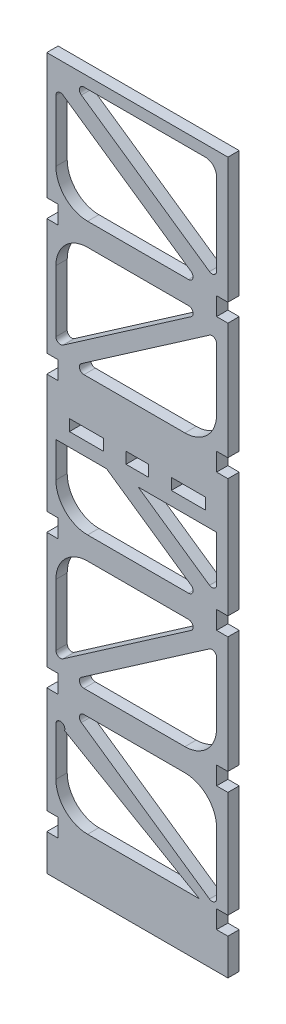
from build123d import *

# Parameters (mm, degrees)
MODEL_W             = 101.6
MODEL_H             = 398.78
BOSS_EXTRUDE1_DEPTH = 6.35
SKETCH1_W           = 6.35
SKETCH1_H           = 10.16
CUT_EXTRUDE1_DEPTH  = 6.35
SKETCH2_W           = 95.776452478
SKETCH2_H           = 26.67
BOSS_EXTRUDE2_DEPTH = 6.35
SKETCH3_W           = 19.05
SKETCH3_H           = 6.35
SKETCH3_W_2         = 12.7
CUT_EXTRUDE2_DEPTH  = 6.35


with BuildPart() as part:
    # Model → Boss-Extrude1 (new body)
    with BuildSketch(Plane.XY):
        with Locations((50.8, 199.39)):
            Rectangle(MODEL_W, MODEL_H)
        with BuildLine():
            Line((77.47, 87.63), (20.83121403, 87.63))
            ThreePointArc((20.83121403, 87.63), (18.406749642, 85.847345646), (19.385420684, 83.001631833))
            Line((19.385420684, 83.001631833), (91.264206654, 33.239395393))
            ThreePointArc((91.264206654, 33.239395393), (93.888830968, 33.077884107), (95.25, 35.32776356))
            Line((95.25, 35.32776356), (95.25, 69.85))
            ThreePointArc((95.25, 69.85), (90.042358569, 82.422358569), (77.47, 87.63))
        make_face(mode=Mode.SUBTRACT)
        with BuildLine():
            Line((5.110654516, 145.400145775), (5.110654516, 110.877909335))
            ThreePointArc((5.110654516, 110.877909335), (6.471823548, 108.628029883), (9.096447862, 108.789541168))
            Line((9.096447862, 108.789541168), (80.975233831, 158.551777608))
            ThreePointArc((80.975233831, 158.551777608), (81.953904874, 161.397491422), (79.529440485, 163.180145775))
            Line((79.529440485, 163.180145775), (22.890654516, 163.180145775))
            ThreePointArc((22.890654516, 163.180145775), (10.318295946, 157.972504345), (5.110654516, 145.400145775))
        make_face(mode=Mode.SUBTRACT)
        with BuildLine():
            Line((77.47, 240.03), (20.83121403, 240.03))
            ThreePointArc((20.83121403, 240.03), (18.406749642, 238.247345646), (19.385420684, 235.401631833))
            Line((19.385420684, 235.401631833), (91.264206654, 185.639395393))
            ThreePointArc((91.264206654, 185.639395393), (93.888830968, 185.477884107), (95.25, 187.72776356))
            Line((95.25, 187.72776356), (95.25, 222.25))
            ThreePointArc((95.25, 222.25), (90.042358569, 234.822358569), (77.47, 240.03))
        make_face(mode=Mode.SUBTRACT)
        with BuildLine():
            Line((22.890654516, 175.880145775), (79.529440485, 175.880145775))
            ThreePointArc((79.529440485, 175.880145775), (81.953904874, 177.662800129), (80.975233831, 180.508513942))
            Line((80.975233831, 180.508513942), (9.096447862, 230.270750382))
            ThreePointArc((9.096447862, 230.270750382), (6.471823548, 230.432261668), (5.110654516, 228.182382216))
            Line((5.110654516, 228.182382216), (5.110654516, 193.660145775))
            ThreePointArc((5.110654516, 193.660145775), (10.318295946, 181.087787206), (22.890654516, 175.880145775))
        make_face(mode=Mode.SUBTRACT)
        with BuildLine():
            Line((91.264206654, 154.720604607), (19.385420684, 104.958368167))
            ThreePointArc((19.385420684, 104.958368167), (18.406749642, 102.112654354), (20.83121403, 100.33))
            Line((20.83121403, 100.33), (77.47, 100.33))
            ThreePointArc((77.47, 100.33), (90.042358569, 105.537641431), (95.25, 118.11))
            Line((95.25, 118.11), (95.25, 152.63223644))
            ThreePointArc((95.25, 152.63223644), (93.888830968, 154.882115893), (91.264206654, 154.720604607))
        make_face(mode=Mode.SUBTRACT)
        with BuildLine():
            Line((5.110654516, 297.800145775), (5.110654516, 263.277909335))
            ThreePointArc((5.110654516, 263.277909335), (6.471823548, 261.028029883), (9.096447862, 261.189541168))
            Line((9.096447862, 261.189541168), (80.975233831, 310.951777608))
            ThreePointArc((80.975233831, 310.951777608), (81.953904874, 313.797491422), (79.529440485, 315.580145775))
            Line((79.529440485, 315.580145775), (22.890654516, 315.580145775))
            ThreePointArc((22.890654516, 315.580145775), (10.318295946, 310.372504345), (5.110654516, 297.800145775))
        make_face(mode=Mode.SUBTRACT)
        with BuildLine():
            Line((88.9, 392.43), (20.83121403, 392.43))
            ThreePointArc((20.83121403, 392.43), (18.406749642, 390.647345646), (19.385420684, 387.801631833))
            Line((19.385420684, 387.801631833), (91.264206654, 338.039395393))
            ThreePointArc((91.264206654, 338.039395393), (93.888830968, 337.877884107), (95.25, 340.12776356))
            Line((95.25, 340.12776356), (95.25, 386.08))
            ThreePointArc((95.25, 386.08), (93.390128061, 390.570128061), (88.9, 392.43))
        make_face(mode=Mode.SUBTRACT)
        with BuildLine():
            Line((22.890654516, 328.280145775), (79.529440485, 328.280145775))
            ThreePointArc((79.529440485, 328.280145775), (81.953904874, 330.062800129), (80.975233831, 332.908513942))
            Line((80.975233831, 332.908513942), (9.096447862, 382.670750382))
            ThreePointArc((9.096447862, 382.670750382), (6.471823548, 382.832261668), (5.110654516, 380.582382216))
            Line((5.110654516, 380.582382216), (5.110654516, 346.060145775))
            ThreePointArc((5.110654516, 346.060145775), (10.318295946, 333.487787206), (22.890654516, 328.280145775))
        make_face(mode=Mode.SUBTRACT)
        with BuildLine():
            Line((22.890654516, 30.48), (85.626201641, 30.48))
            Line((85.626201641, 30.48), (10.005950978, 74.34818594))
            ThreePointArc((10.005950978, 74.34818594), (8.258764757, 77.658550083), (5.110654516, 75.633563082))
            Line((5.110654516, 75.633563082), (5.110654516, 48.26))
            ThreePointArc((5.110654516, 48.26), (10.318295946, 35.687641431), (22.890654516, 30.48))
        make_face(mode=Mode.SUBTRACT)
        with BuildLine():
            Line((91.264206654, 307.120604607), (19.385420684, 257.358368167))
            ThreePointArc((19.385420684, 257.358368167), (18.406749642, 254.512654354), (20.83121403, 252.73))
            Line((20.83121403, 252.73), (77.47, 252.73))
            ThreePointArc((77.47, 252.73), (90.042358569, 257.937641431), (95.25, 270.51))
            Line((95.25, 270.51), (95.25, 305.03223644))
            ThreePointArc((95.25, 305.03223644), (93.888830968, 307.282115893), (91.264206654, 307.120604607))
        make_face(mode=Mode.SUBTRACT)
    extrude(amount=BOSS_EXTRUDE1_DEPTH)

    # Sketch1 → Cut-Extrude1 (cut)
    with BuildSketch(Plane.XY.offset(6.35)):
        with Locations((98.425, 323.200145775)):
            Rectangle(SKETCH1_W, SKETCH1_H)
        with Locations((98.425, 247.65)):
            Rectangle(SKETCH1_W, SKETCH1_H)
        with Locations((3.175, 247.65)):
            Rectangle(SKETCH1_W, SKETCH1_H)
        with Locations((3.175, 25.4)):
            Rectangle(SKETCH1_W, SKETCH1_H)
        with Locations((98.425, 170.800145775)):
            Rectangle(SKETCH1_W, SKETCH1_H)
        with Locations((3.175, 323.200145775)):
            Rectangle(SKETCH1_W, SKETCH1_H)
        with Locations((98.425, 25.4)):
            Rectangle(SKETCH1_W, SKETCH1_H)
        with Locations((98.425, 95.25)):
            Rectangle(SKETCH1_W, SKETCH1_H)
        with Locations((3.175, 95.25)):
            Rectangle(SKETCH1_W, SKETCH1_H)
        with Locations((3.175, 170.800145775)):
            Rectangle(SKETCH1_W, SKETCH1_H)
    extrude(amount=-CUT_EXTRUDE1_DEPTH, mode=Mode.SUBTRACT)

    # Sketch2 → Boss-Extrude2 (add)
    with BuildSketch(Plane.XY.offset(6.35)):
        with Locations((49.666030554, 226.695)):
            Rectangle(SKETCH2_W, SKETCH2_H)
    extrude(amount=-BOSS_EXTRUDE2_DEPTH)

    # Sketch3 → Cut-Extrude2 (cut)
    with BuildSketch(Plane.XY.offset(6.35)):
        with Locations((79.375, 224.155)):
            Rectangle(SKETCH3_W, SKETCH3_H)
        with Locations((22.225, 224.155)):
            Rectangle(SKETCH3_W, SKETCH3_H)
        with Locations((50.8, 224.155)):
            Rectangle(SKETCH3_W_2, SKETCH3_H)
    extrude(amount=-CUT_EXTRUDE2_DEPTH, mode=Mode.SUBTRACT)


solid = part.part
